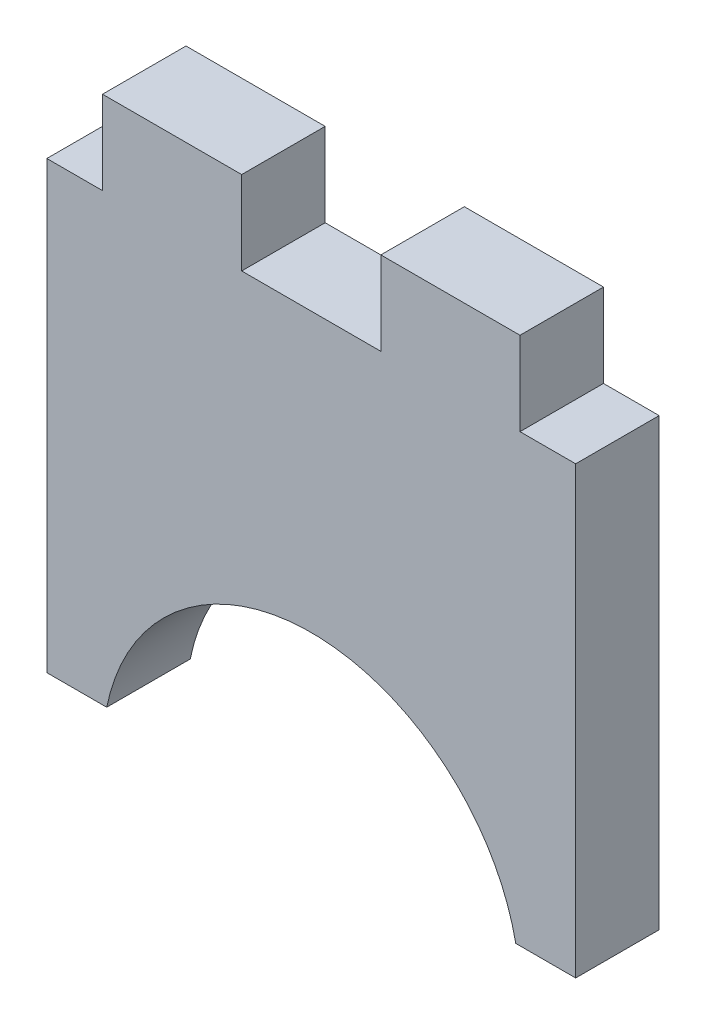
from build123d import *

# Parameters (mm, degrees)
BOSS_EXTRUDE1_DEPTH = 6


with BuildPart() as part:
    # Sketch1 → Boss-Extrude1 (new body)
    with BuildSketch(Plane.XY):
        with BuildLine():
            Line((-38, 35), (-38, 4))
            Line((-38, 4), (-38, 3))
            Line((-38, 3), (-33.696938457, 3))
            ThreePointArc((-33.696938457, 3), (-19, 15), (-4.303061543, 3))
            Line((-4.303061543, 3), (0, 3))
            Line((0, 3), (0, 4))
            Line((0, 4), (0, 35))
            Line((0, 35), (-4, 35))
            Line((-4, 35), (-4, 41))
            Line((-4, 41), (-14, 41))
            Line((-14, 41), (-14, 35))
            Line((-14, 35), (-24, 35))
            Line((-24, 35), (-24, 41))
            Line((-24, 41), (-34, 41))
            Line((-34, 41), (-34, 35))
            Line((-34, 35), (-38, 35))
        make_face()
    extrude(amount=BOSS_EXTRUDE1_DEPTH)


solid = part.part
